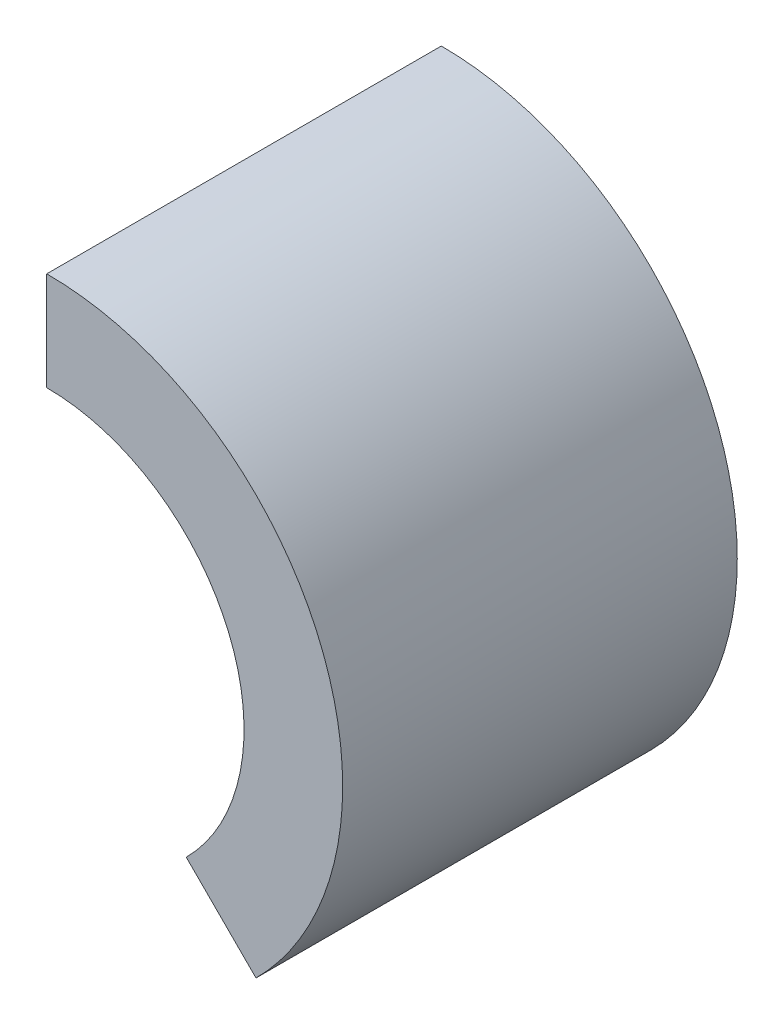
from build123d import *

# Parameters (mm, degrees)
SALIENTE_EXTRUIR1_DEPTH = 40


with BuildPart() as part:
    # Croquis1 → Saliente-Extruir1 (new body)
    with BuildSketch(Plane.XY):
        with BuildLine():
            Line((0, 30), (0, 20))
            ThreePointArc((0, 20), (18.47759065, 7.653668647), (14.142135624, -14.142135624))
            Line((14.142135624, -14.142135624), (21.213203436, -21.213203436))
            ThreePointArc((21.213203436, -21.213203436), (27.716385975, 11.480502971), (0, 30))
        make_face()
    extrude(amount=SALIENTE_EXTRUIR1_DEPTH)


solid = part.part
